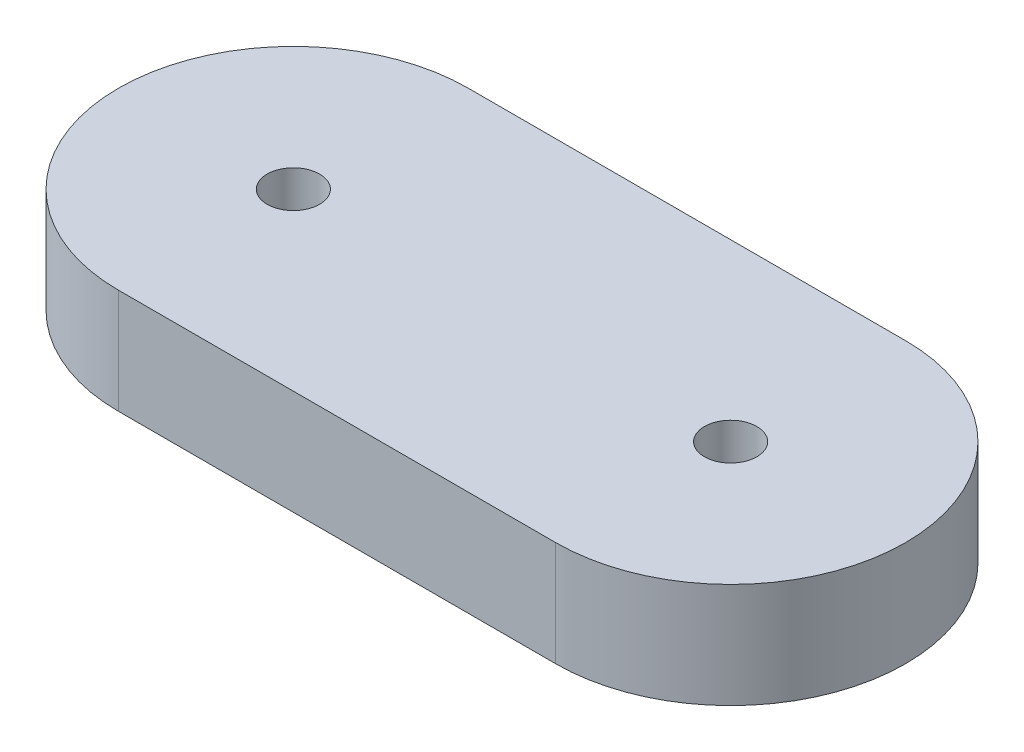
from build123d import *

# Parameters (mm, degrees)
SKETCH1_R           = 1.5
BOSS_EXTRUDE1_DEPTH = 6


with BuildPart() as part:
    # Sketch1 → Boss-Extrude1 (new body)
    with BuildSketch(Plane(origin=(0, 0, 0), x_dir=(1, 0, 0), z_dir=(0, 1, 0))):
        with BuildLine():
            Line((-12.5, 10), (0, 10))
            Line((0, 10), (0, -10))
            Line((0, -10), (-12.5, -10))
            ThreePointArc((-12.5, -10), (-22.5, 0), (-12.5, 10))
        make_face()
        with Locations(Location((-12.5, 0, 0), (0, 0, 270))):
            Circle(SKETCH1_R, mode=Mode.SUBTRACT)
    boss_extrude1 = extrude(amount=BOSS_EXTRUDE1_DEPTH)

    # Mirror1: Boss-Extrude1 across plane
    add(boss_extrude1.mirror(Plane(origin=(0, 6, -10), x_dir=(0, 0, 1), z_dir=(-1, 0, 0))))


solid = part.part
